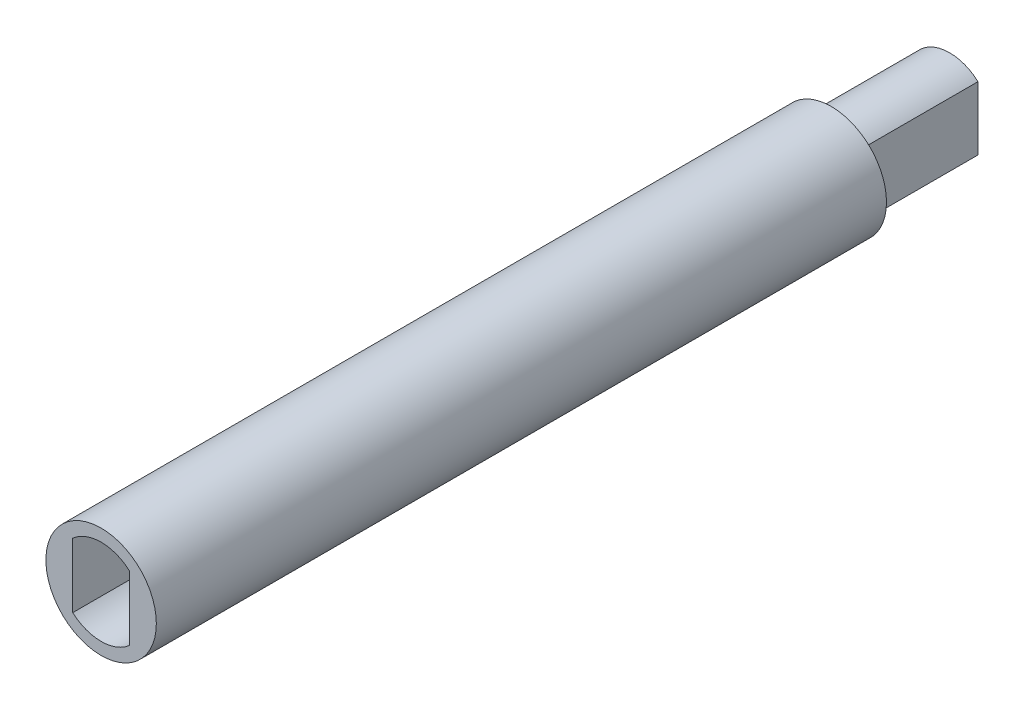
from build123d import *

# Parameters (mm, degrees)
CROQUIS1_R              = 3.5
SALIENTE_EXTRUIR1_DEPTH = 65.5
CORTAR_EXTRUIR3_DEPTH   = 8
CORTAR_EXTRUIR5_START   = -20
CROQUIS7_R              = 3.5
CORTAR_EXTRUIR5_DEPTH   = 20
CROQUIS8_W              = 12.617225576
CROQUIS8_H              = 9.28288649
CORTAR_EXTRUIR6_DEPTH   = 10
SALIENTE_EXTRUIR2_START = 2.5
CROQUIS10_R             = 3.5
SALIENTE_EXTRUIR2_DEPTH = 2.5
CROQUIS11_R             = 3.5
CORTAR_EXTRUIR7_DEPTH   = 1.72


with BuildPart() as part:
    # Croquis1 → Saliente-Extruir1 (new body)
    with BuildSketch(Plane.XY):
        Circle(CROQUIS1_R)
    extrude(amount=-SALIENTE_EXTRUIR1_DEPTH)

    # Croquis6 → Cortar-Extruir3 (cut)
    with BuildSketch(Plane.XY):
        with BuildLine():
            Line((-1.8, 2.045880006), (-1.8, -2.045880006))
            ThreePointArc((-1.8, -2.045880006), (0, -2.725), (1.8, -2.045880006))
            Line((1.8, -2.045880006), (1.8, 2.045880006))
            ThreePointArc((1.8, 2.045880006), (0, 2.725), (-1.8, 2.045880006))
        make_face()
    extrude(amount=-CORTAR_EXTRUIR3_DEPTH, mode=Mode.SUBTRACT)

    # Croquis7 → Cortar-Extruir5 (cut)
    with BuildSketch(Plane(origin=(0, 0, -65.5), x_dir=(-1, 0, 0), z_dir=(0, 0, -1)).offset(CORTAR_EXTRUIR5_START)):
        with Locations(Location((0, 0, 0), (0, 0, 180))):
            Circle(CROQUIS7_R)
        with BuildLine():
            ThreePointArc((1.8, 2.01246118), (0, 2.7), (-1.8, 2.01246118))
            Line((-1.8, 2.01246118), (-1.8, -2.01246118))
            ThreePointArc((-1.8, -2.01246118), (0, -2.7), (1.8, -2.01246118))
            Line((1.8, -2.01246118), (1.8, 2.01246118))
        make_face(mode=Mode.SUBTRACT)
    extrude(amount=CORTAR_EXTRUIR5_DEPTH, mode=Mode.SUBTRACT)

    # Croquis8 → Cortar-Extruir6 (cut)
    with BuildSketch(Plane.ZY.offset(1.8)):
        with Locations((-59.308612788, -0.436721269)):
            Rectangle(CROQUIS8_W, CROQUIS8_H)
    extrude(amount=-CORTAR_EXTRUIR6_DEPTH, mode=Mode.SUBTRACT)

    # Croquis10 → Saliente-Extruir2 (add)
    with BuildSketch(Plane.XY.offset(SALIENTE_EXTRUIR2_START)):
        Circle(CROQUIS10_R)
        with BuildLine():
            Line((-1.8, 2.045880006), (-1.8, -2.045880006))
            ThreePointArc((-1.8, -2.045880006), (0, -2.725), (1.8, -2.045880006))
            Line((1.8, -2.045880006), (1.8, 2.045880006))
            ThreePointArc((1.8, 2.045880006), (0, 2.725), (-1.8, 2.045880006))
        make_face(mode=Mode.SUBTRACT)
    extrude(amount=-SALIENTE_EXTRUIR2_DEPTH)

    # Croquis11 → Cortar-Extruir7 (cut)
    with BuildSketch(Plane.XY.offset(2.5)):
        Circle(CROQUIS11_R)
    extrude(amount=-CORTAR_EXTRUIR7_DEPTH, mode=Mode.SUBTRACT)


solid = part.part
